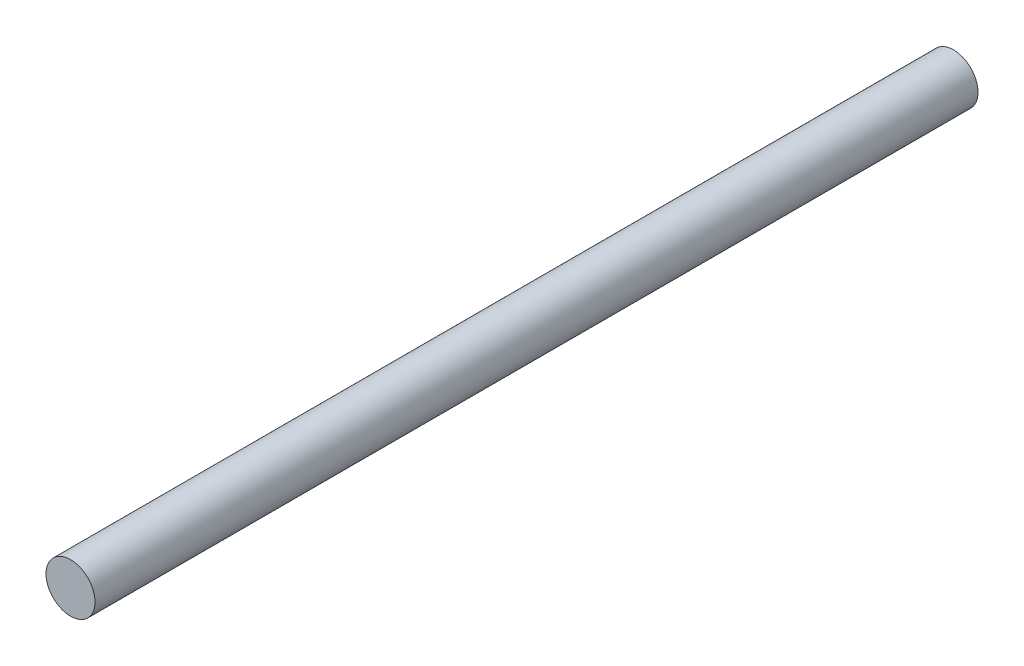
from build123d import *

# Parameters (mm, degrees)
SKETCH1_R           = 12.7
BOSS_EXTRUDE1_DEPTH = 457.2


with BuildPart() as part:
    # Sketch1 → Boss-Extrude1 (new body)
    with BuildSketch(Plane.XY):
        with Locations(Location((0, 0, 0), (0, 0, 180))):
            Circle(SKETCH1_R)
    extrude(amount=BOSS_EXTRUDE1_DEPTH)


solid = part.part
